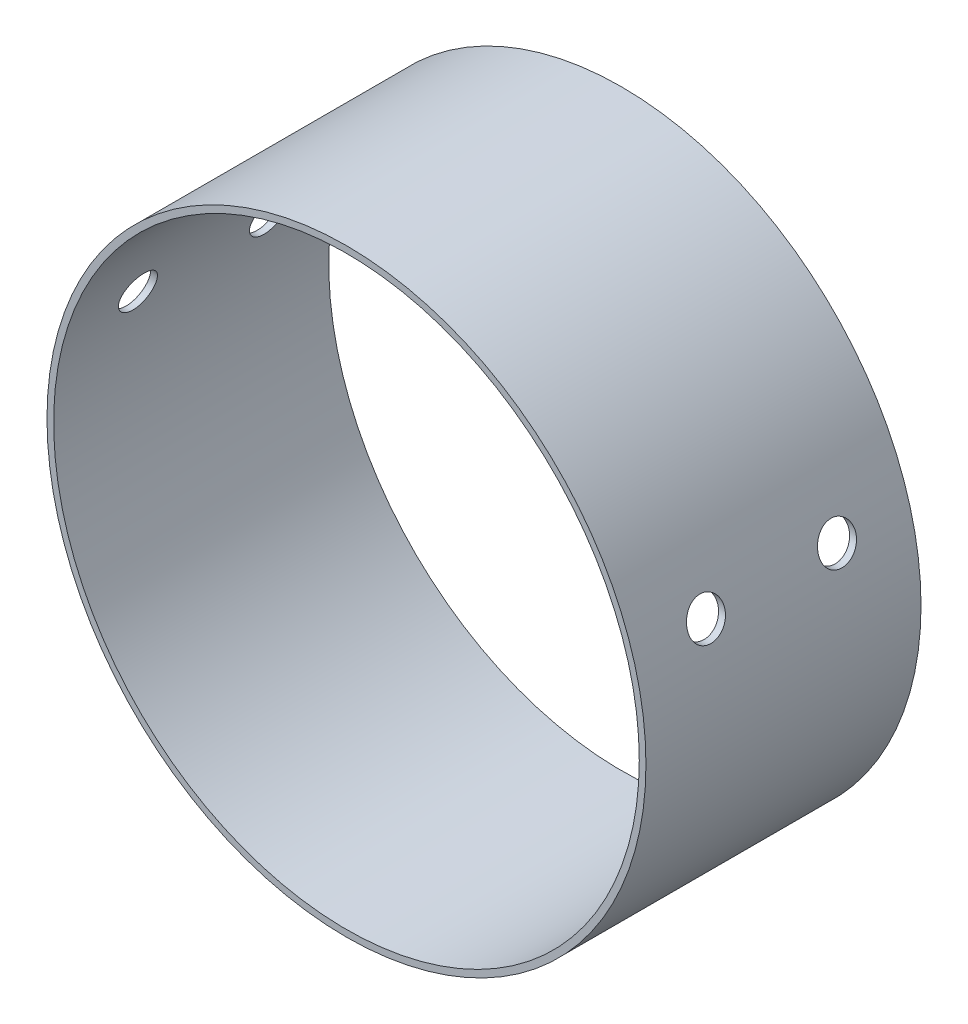
from build123d import *

# Parameters (mm, degrees)
SKETCH1_R               = 50.8
SKETCH1_R_2             = 49.6697
BOSS_EXTRUDE1_DEPTH     = 23.3299
CUT_EXTRUDE1_DEPTH      = 76.535185404
CUT_EXTRUDE1_DEPTH_BACK = 76.535185404
SKETCH2_R               = 3.175


with BuildPart() as part:
    # Sketch1 → Boss-Extrude1 (new, symmetric)
    with BuildSketch(Plane.XY):
        Circle(SKETCH1_R)
        Circle(SKETCH1_R_2, mode=Mode.SUBTRACT)
    extrude(amount=BOSS_EXTRUDE1_DEPTH, both=True)

    # Sketch2 → Cut-Extrude1 (cut, two sides: drawn at the far end of the back side and taken through both)
    with BuildSketch(Plane(origin=(0, 0, 0), x_dir=(0, 0, -1), z_dir=(1, 0, 0)).offset(-CUT_EXTRUDE1_DEPTH_BACK)):
        with Locations((-11.1125, 14.20368)):
            Circle(SKETCH2_R)
        with Locations((11.1125, 14.20368)):
            Circle(SKETCH2_R)
    extrude(amount=CUT_EXTRUDE1_DEPTH + CUT_EXTRUDE1_DEPTH_BACK, mode=Mode.SUBTRACT)


solid = part.part
